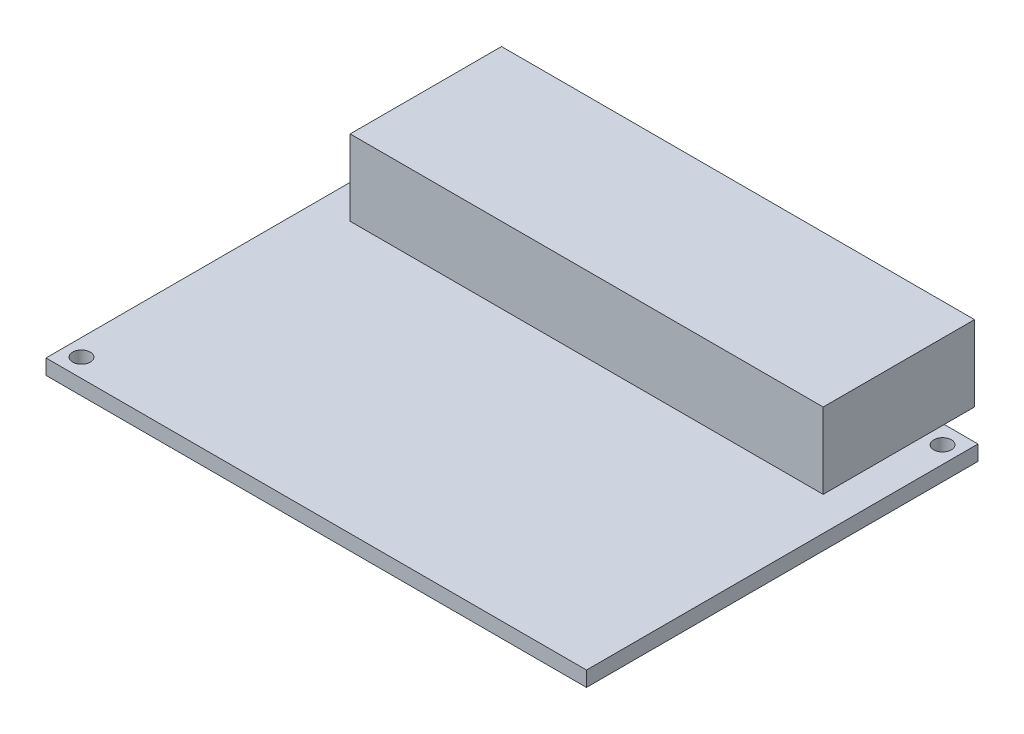
from build123d import *

# Parameters (mm, degrees)
SKETCH1_W           = 90.7
SKETCH1_H           = 65.7
SKETCH1_R           = 1.4732
BOSS_EXTRUDE1_DEPTH = 2.54
SKETCH2_W           = 79.375
SKETCH2_H           = 25.4
BOSS_EXTRUDE2_DEPTH = 12.7


with BuildPart() as part:
    # Sketch1 → Boss-Extrude1 (new body)
    with BuildSketch(Plane(origin=(0, 0, 0), x_dir=(1, 0, 0), z_dir=(0, 1, 0))):
        Rectangle(SKETCH1_W, SKETCH1_H)
        with Locations(Location((-42.5, 29.75, 0), (0, 0, 270))):
            Circle(SKETCH1_R, mode=Mode.SUBTRACT)
        with Locations(Location((42.5, 29.75, 0), (0, 0, 270))):
            Circle(SKETCH1_R, mode=Mode.SUBTRACT)
        with Locations(Location((-42.5, -29.75, 0), (0, 0, 270))):
            Circle(SKETCH1_R, mode=Mode.SUBTRACT)
    extrude(amount=BOSS_EXTRUDE1_DEPTH)

    # Sketch2 → Boss-Extrude2 (add)
    with BuildSketch(Plane(origin=(0, 2.54, 0), x_dir=(1, 0, 0), z_dir=(0, 1, 0))):
        with Locations((0, 25.23)):
            Rectangle(SKETCH2_W, SKETCH2_H)
    extrude(amount=BOSS_EXTRUDE2_DEPTH)


solid = part.part
